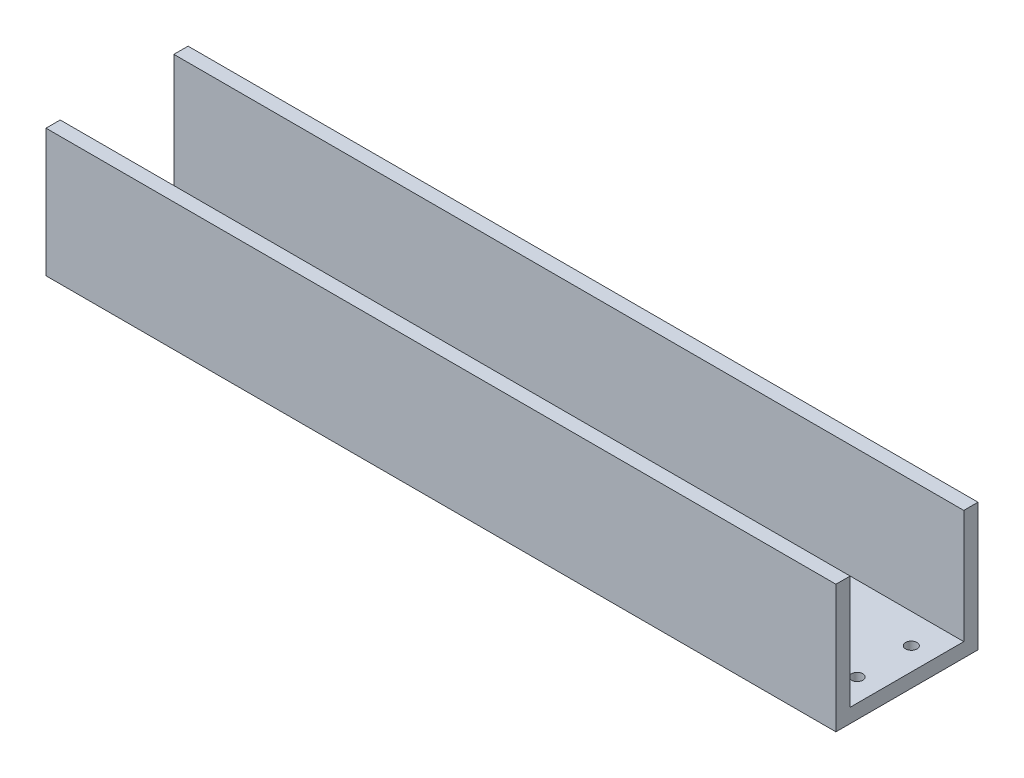
from build123d import *

# Parameters (mm, degrees)
BOSS_EXTRUDE1_DEPTH = 278
CUT_EXTRUDE3_REACH  = 287.279
SKETCH2_R           = 2


with BuildPart() as part:
    # Sketch1 → Boss-Extrude1 (new body)
    with BuildSketch(Plane(origin=(0, 0, 0), x_dir=(0, 0, -1), z_dir=(1, 0, 0))):
        Polygon((0, 0), (50, 0), (50, 45), (45, 45), (45, 5), (5, 5), (5, 45), (0, 45), align=None)
    extrude(amount=BOSS_EXTRUDE1_DEPTH)

    # Sketch2 → Cut-Extrude3 (cut, up to next)
    with BuildSketch(Plane(origin=(0, 5, 0), x_dir=(1, 0, 0), z_dir=(0, 1, 0)), mode=Mode.PRIVATE) as cut_extrude3_sk1:
        with Locations(Location((8, 15.475, 0), (0, 0, 270))):
            Circle(SKETCH2_R)
    cut_extrude3_tool1 = extrude(cut_extrude3_sk1.sketch, amount=-CUT_EXTRUDE3_REACH, mode=Mode.PRIVATE) & part.part
    # Sketch2 → Cut-Extrude3 (cut, up to next)
    with BuildSketch(Plane(origin=(0, 5, 0), x_dir=(1, 0, 0), z_dir=(0, 1, 0)), mode=Mode.PRIVATE) as cut_extrude3_sk2:
        with Locations(Location((55, 15.475, 0), (0, 0, 270))):
            Circle(SKETCH2_R)
    cut_extrude3_tool2 = extrude(cut_extrude3_sk2.sketch, amount=-CUT_EXTRUDE3_REACH, mode=Mode.PRIVATE) & part.part
    # Sketch2 → Cut-Extrude3 (cut, up to next)
    with BuildSketch(Plane(origin=(0, 5, 0), x_dir=(1, 0, 0), z_dir=(0, 1, 0)), mode=Mode.PRIVATE) as cut_extrude3_sk3:
        with Locations(Location((55, 34.525, 0), (0, 0, 270))):
            Circle(SKETCH2_R)
    cut_extrude3_tool3 = extrude(cut_extrude3_sk3.sketch, amount=-CUT_EXTRUDE3_REACH, mode=Mode.PRIVATE) & part.part
    # Sketch2 → Cut-Extrude3 (cut, up to next)
    with BuildSketch(Plane(origin=(0, 5, 0), x_dir=(1, 0, 0), z_dir=(0, 1, 0)), mode=Mode.PRIVATE) as cut_extrude3_sk4:
        with Locations(Location((8, 34.525, 0), (0, 0, 270))):
            Circle(SKETCH2_R)
    cut_extrude3_tool4 = extrude(cut_extrude3_sk4.sketch, amount=-CUT_EXTRUDE3_REACH, mode=Mode.PRIVATE) & part.part
    # Sketch2 → Cut-Extrude3 (cut, up to next)
    with BuildSketch(Plane(origin=(0, 5, 0), x_dir=(1, 0, 0), z_dir=(0, 1, 0)), mode=Mode.PRIVATE) as cut_extrude3_sk5:
        with Locations(Location((270, 34.525, 0), (0, 0, 270))):
            Circle(SKETCH2_R)
    cut_extrude3_tool5 = extrude(cut_extrude3_sk5.sketch, amount=-CUT_EXTRUDE3_REACH, mode=Mode.PRIVATE) & part.part
    # Sketch2 → Cut-Extrude3 (cut, up to next)
    with BuildSketch(Plane(origin=(0, 5, 0), x_dir=(1, 0, 0), z_dir=(0, 1, 0)), mode=Mode.PRIVATE) as cut_extrude3_sk6:
        with Locations(Location((223, 34.525, 0), (0, 0, 270))):
            Circle(SKETCH2_R)
    cut_extrude3_tool6 = extrude(cut_extrude3_sk6.sketch, amount=-CUT_EXTRUDE3_REACH, mode=Mode.PRIVATE) & part.part
    # Sketch2 → Cut-Extrude3 (cut, up to next)
    with BuildSketch(Plane(origin=(0, 5, 0), x_dir=(1, 0, 0), z_dir=(0, 1, 0)), mode=Mode.PRIVATE) as cut_extrude3_sk7:
        with Locations(Location((223, 15.475, 0), (0, 0, 270))):
            Circle(SKETCH2_R)
    cut_extrude3_tool7 = extrude(cut_extrude3_sk7.sketch, amount=-CUT_EXTRUDE3_REACH, mode=Mode.PRIVATE) & part.part
    # Sketch2 → Cut-Extrude3 (cut, up to next)
    with BuildSketch(Plane(origin=(0, 5, 0), x_dir=(1, 0, 0), z_dir=(0, 1, 0)), mode=Mode.PRIVATE) as cut_extrude3_sk8:
        with Locations(Location((270, 15.475, 0), (0, 0, 270))):
            Circle(SKETCH2_R)
    cut_extrude3_tool8 = extrude(cut_extrude3_sk8.sketch, amount=-CUT_EXTRUDE3_REACH, mode=Mode.PRIVATE) & part.part
    add(cut_extrude3_tool1.solids().sort_by_distance((8, 5, -15.475))[0], mode=Mode.SUBTRACT)
    add(cut_extrude3_tool2.solids().sort_by_distance((55, 5, -15.475))[0], mode=Mode.SUBTRACT)
    add(cut_extrude3_tool3.solids().sort_by_distance((55, 5, -34.525))[0], mode=Mode.SUBTRACT)
    add(cut_extrude3_tool4.solids().sort_by_distance((8, 5, -34.525))[0], mode=Mode.SUBTRACT)
    add(cut_extrude3_tool5.solids().sort_by_distance((270, 5, -34.525))[0], mode=Mode.SUBTRACT)
    add(cut_extrude3_tool6.solids().sort_by_distance((223, 5, -34.525))[0], mode=Mode.SUBTRACT)
    add(cut_extrude3_tool7.solids().sort_by_distance((223, 5, -15.475))[0], mode=Mode.SUBTRACT)
    add(cut_extrude3_tool8.solids().sort_by_distance((270, 5, -15.475))[0], mode=Mode.SUBTRACT)


solid = part.part
